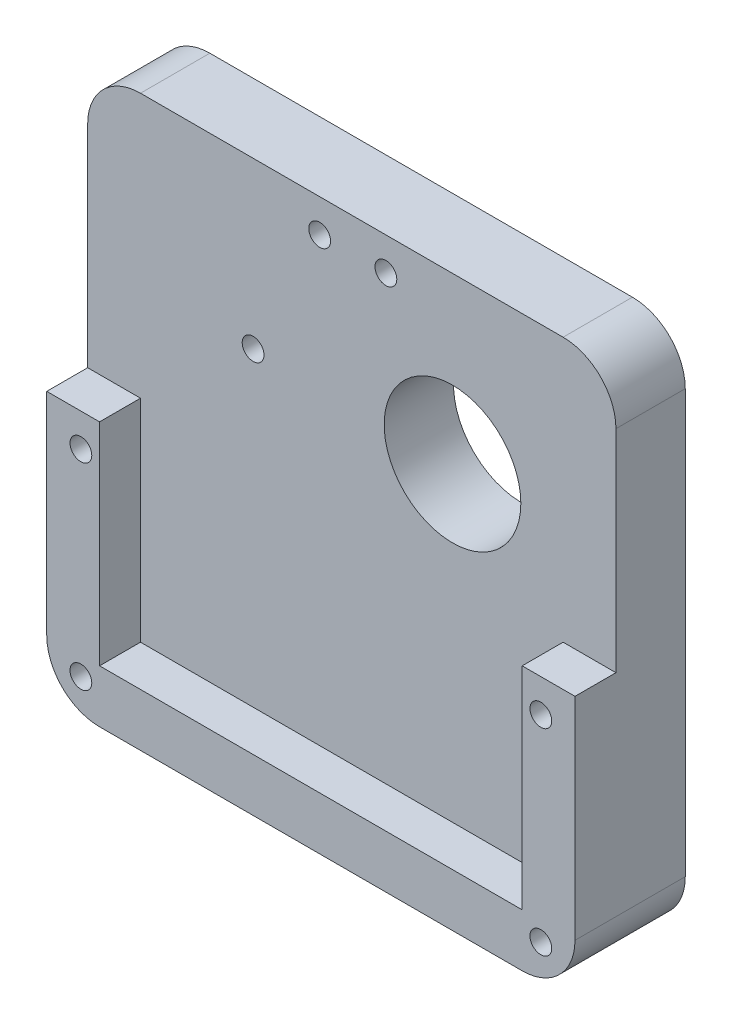
from build123d import *

# Parameters (mm, degrees)
SKETCH_1_W               = 80
SKETCH_1_H               = 80
EXTRUDE_1_DEPTH          = 10.5
SKETCH_3_R               = 1.65
SKETCH_3_R_2             = 10.35
CUT_EXTRUDE_1_DEPTH      = 62.116691664
FILLET_3_R               = 8
FILLET_4_R               = 8
FILLET_5_R               = 8
FILLET_6_R               = 8
EXTRUDE_START            = 6.2
EXTRUDE_2_DEPTH          = 6.2
CUT_EXTRUDE_2_DEPTH      = 62.116691664
CUT_EXTRUDE_2_DEPTH_BACK = 62.116691664
SKETCH_12_R              = 1.65


with BuildPart() as part:
    # 草图1 → 凸台-拉伸1 (new body)
    with BuildSketch(Plane.XY):
        with Locations((-5, 0)):
            Rectangle(SKETCH_1_W, SKETCH_1_H)
    extrude(amount=EXTRUDE_1_DEPTH)

    # 草图3 → 切除-拉伸1 (cut, through all)
    with BuildSketch(Plane.XY.offset(10.5)):
        with Locations((-19.95, 15)):
            Circle(SKETCH_3_R)
        with Locations((-9.86238383, 35)):
            Circle(SKETCH_3_R)
        with Locations((0.16238383, 35)):
            Circle(SKETCH_3_R)
        with Locations((10.25, 15)):
            Circle(SKETCH_3_R_2)
    extrude(amount=-CUT_EXTRUDE_1_DEPTH, mode=Mode.SUBTRACT)

    # 圆角3
    fillet_3_edges = [part.edges().sort_by_distance(p)[0] for p in [
        (35, 40, 5.25),
    ]]
    fillet(fillet_3_edges, radius=FILLET_3_R)

    # 圆角4
    fillet_4_edges = [part.edges().sort_by_distance(p)[0] for p in [
        (-45, 40, 5.25),
    ]]
    fillet(fillet_4_edges, radius=FILLET_4_R)

    # 圆角5
    fillet_5_edges = [part.edges().sort_by_distance(p)[0] for p in [
        (-45, -40, 5.25),
    ]]
    fillet(fillet_5_edges, radius=FILLET_5_R)

    # 圆角6
    fillet_6_edges = [part.edges().sort_by_distance(p)[0] for p in [
        (35, -40, 5.25),
    ]]
    fillet(fillet_6_edges, radius=FILLET_6_R)

    # 草图11 → 凸台-拉伸2 (add)
    with BuildSketch(Plane.XY.offset(10.5).offset(EXTRUDE_START)):
        with BuildLine():
            Line((-45, 0), (-37, 0))
            Line((-37, 0), (-37, -32))
            Line((-37, -32), (27, -32))
            Line((27, -32), (27, 0))
            Line((27, 0), (35, 0))
            Line((35, 0), (35, -32))
            ThreePointArc((35, -32), (32.656854249, -37.656854249), (27, -40))
            Line((27, -40), (-37, -40))
            ThreePointArc((-37, -40), (-42.656854249, -37.656854249), (-45, -32))
            Line((-45, -32), (-45, 0))
        make_face()
    extrude(amount=-EXTRUDE_2_DEPTH)

    # 草图12 → 切除-拉伸2 (cut, two sides: drawn at the far end of the back side and taken through both)
    with BuildSketch(Plane.XY.offset(10.5).offset(-CUT_EXTRUDE_2_DEPTH_BACK)):
        with Locations((29.828427125, -34.828427125)):
            Circle(SKETCH_12_R)
        with Locations((-39.828427125, -34.828427125)):
            Circle(SKETCH_12_R)
        with Locations((-39.828427125, -5)):
            Circle(SKETCH_12_R)
        with Locations((29.828427125, -5)):
            Circle(SKETCH_12_R)
    extrude(amount=CUT_EXTRUDE_2_DEPTH + CUT_EXTRUDE_2_DEPTH_BACK, mode=Mode.SUBTRACT)


solid = part.part
